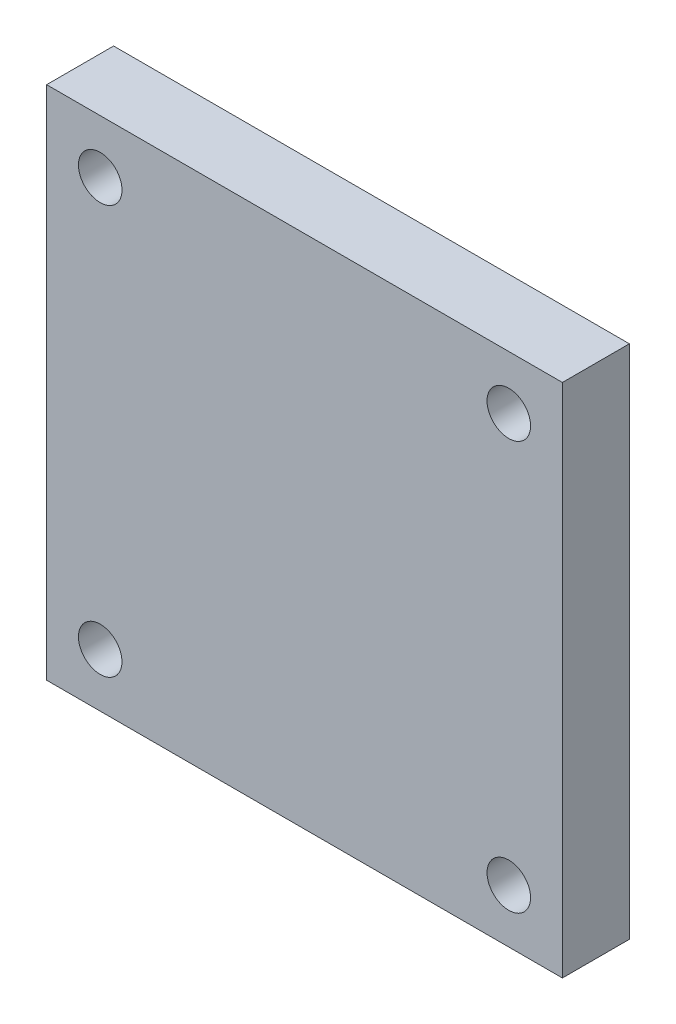
from build123d import *

# Parameters (mm, degrees)
SKETCH1_W           = 154
SKETCH1_H           = 154
SKETCH1_R           = 6.5
BOSS_EXTRUDE1_DEPTH = 10


with BuildPart() as part:
    # Sketch1 → Boss-Extrude1 (new, symmetric)
    with BuildSketch(Plane.XY):
        Rectangle(SKETCH1_W, SKETCH1_H)
        with Locations((-61, 61)):
            Circle(SKETCH1_R, mode=Mode.SUBTRACT)
        with Locations(Location((61, 61, 0), (0, 0, 180))):
            Circle(SKETCH1_R, mode=Mode.SUBTRACT)
        with Locations(Location((-61, -61, 0), (0, 0, 180))):
            Circle(SKETCH1_R, mode=Mode.SUBTRACT)
        with Locations((61, -61)):
            Circle(SKETCH1_R, mode=Mode.SUBTRACT)
    extrude(amount=BOSS_EXTRUDE1_DEPTH, both=True)


solid = part.part
